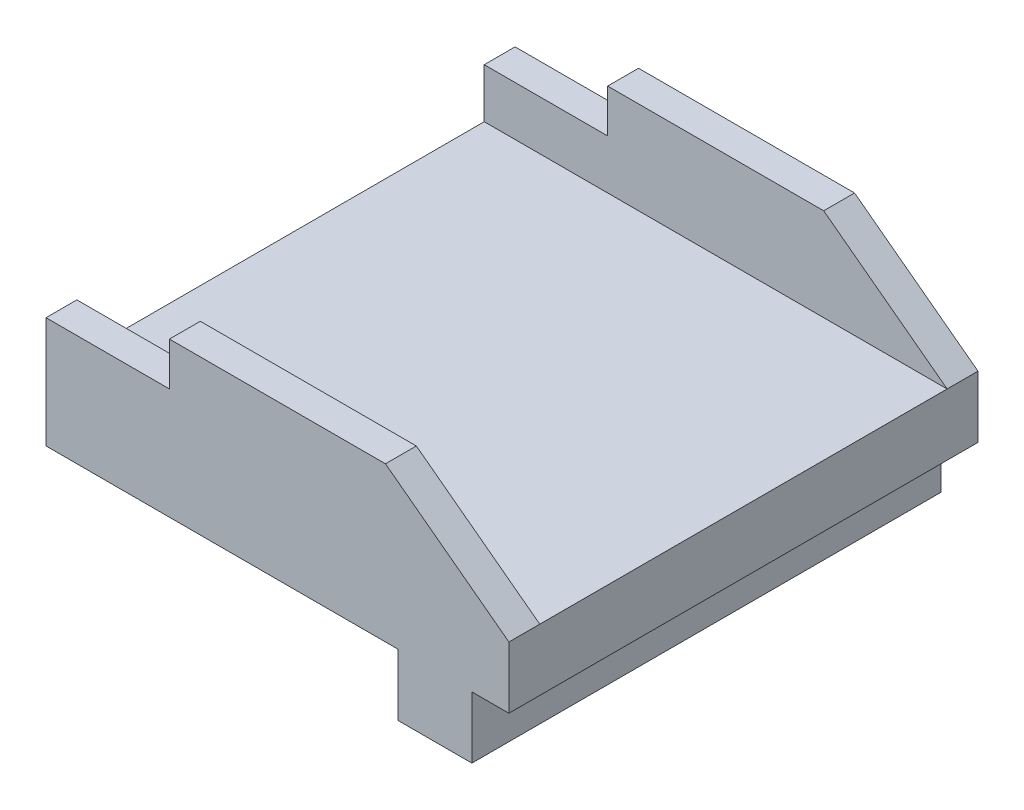
from build123d import *

# Parameters (mm, degrees)
EXTRUDE_1_DEPTH     = 76
SKETCH_2_W          = 66
SKETCH_2_H          = 15
CUT_EXTRUDE_1_DEPTH = 109.200046211


with BuildPart() as part:
    # Эскиз1 → Бобышка-Вытянуть1 (new body)
    with BuildSketch(Plane.XY):
        Polygon((37.5, 2.5), (17.5, 17.5), (-17.5, 17.5), (-17.5, 10.5), (-37.5, 10.5), (-37.5, -7.5), (19.5, -7.5), (19.5, -17.5), (31.5, -17.5), (31.5, -7.5), (37.5, -7.5), align=None)
    extrude(amount=EXTRUDE_1_DEPTH)

    # Эскиз2 → Вырез-Вытянуть1 (cut, through all)
    with BuildSketch(Plane(origin=(37.5, 0, 0), x_dir=(0, 0, -1), z_dir=(1, 0, 0))):
        with Locations((-38, 10)):
            Rectangle(SKETCH_2_W, SKETCH_2_H)
    extrude(amount=-CUT_EXTRUDE_1_DEPTH, mode=Mode.SUBTRACT)


solid = part.part
